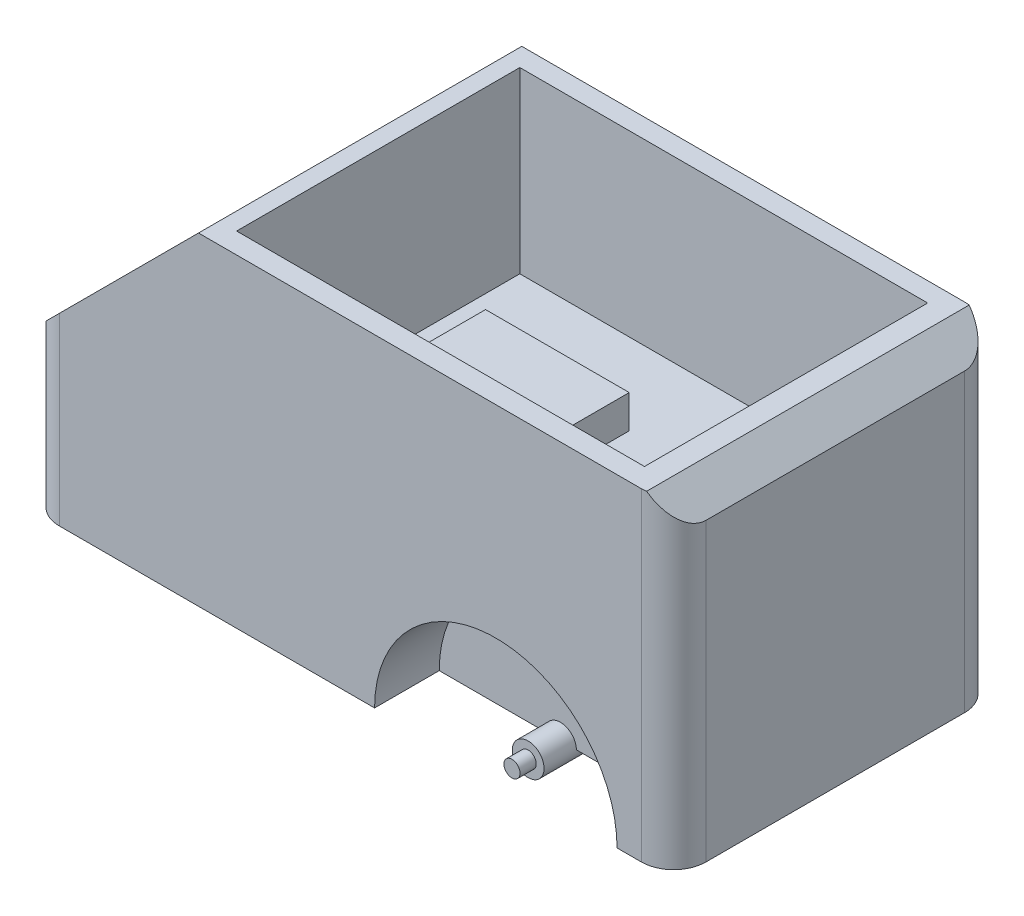
from build123d import *

# Parameters (mm, degrees)
BOSS_EXTRUDE1_DEPTH      = 101.6
SKETCH4_R                = 38.1
CUT_EXTRUDE1_DEPTH       = 20.32
BOSS_EXTRUDE3_DEPTH      = 10.16
BOSS_EXTRUDE3_DEPTH_BACK = 71.12
SKETCH5_R                = 4.993753619
BOSS_EXTRUDE4_DEPTH      = 5.08
BOSS_EXTRUDE4_DEPTH_BACK = 86.36
SKETCH6_R                = 2.54
SKETCH8_R                = 19.05
CUT_EXTRUDE2_DEPTH       = 3.175
SKETCH9_W                = 204.446341232
SKETCH9_H                = 212.005576541
CUT_EXTRUDE3_DEPTH       = 38.1
SKETCH10_W               = 191.95217793
SKETCH10_H               = 158.555264397
CUT_EXTRUDE4_DEPTH       = 6.096
SKETCH11_W               = 128.165166247
SKETCH11_H               = 88.990153167
CUT_EXTRUDE5_DEPTH       = 56.134
SKETCH12_W               = 45.159356145
SKETCH12_H               = 41.954498612
SKETCH12_W_2             = 24.473457524
SKETCH12_H_2             = 41.272764935
SKETCH12_H_3             = 38.685517003
BOSS_EXTRUDE5_DEPTH      = 10.414


with BuildPart() as part:
    # Sketch1 → Boss-Extrude1 (new body)
    with BuildSketch(Plane(origin=(0, 0, 0), x_dir=(1, 0, 0), z_dir=(0, 1, 0))):
        with BuildLine():
            Line((-91.44, 50.8), (91.44, 50.8))
            ThreePointArc((91.44, 50.8), (98.624204897, 47.824204897), (101.6, 40.64))
            Line((101.6, 40.64), (101.6, -40.64))
            ThreePointArc((101.6, -40.64), (98.624204897, -47.824204897), (91.44, -50.8))
            Line((91.44, -50.8), (-91.44, -50.8))
            ThreePointArc((-91.44, -50.8), (-98.624204897, -47.824204897), (-101.6, -40.64))
            Line((-101.6, -40.64), (-101.6, 40.64))
            ThreePointArc((-101.6, 40.64), (-98.624204897, 47.824204897), (-91.44, 50.8))
        make_face()
    extrude(amount=BOSS_EXTRUDE1_DEPTH)

    # Sketch4 → Cut-Extrude1 (cut)
    with BuildSketch(Plane(origin=(0, 0, -50.8), x_dir=(-1, 0, 0), z_dir=(0, 0, -1))):
        with Locations((-45.716232369, 0)):
            Circle(SKETCH4_R)
    cut_extrude1 = extrude(amount=-CUT_EXTRUDE1_DEPTH, mode=Mode.SUBTRACT)

    # Mirror1: Cut-Extrude1 across plane
    add(cut_extrude1.mirror(Plane.XY), mode=Mode.SUBTRACT)

    # Sketch5 → Boss-Extrude3 (add, two sides: drawn at the far end of the back side and taken through both)
    with BuildSketch(Plane(origin=(0, 0, -30.48), x_dir=(-1, 0, 0), z_dir=(0, 0, -1)).offset(-BOSS_EXTRUDE3_DEPTH_BACK)):
        with Locations((-45.716232369, 0)):
            Circle(SKETCH5_R)
    extrude(amount=BOSS_EXTRUDE3_DEPTH + BOSS_EXTRUDE3_DEPTH_BACK)

    # Sketch6 → Boss-Extrude4 (add, two sides: drawn at the far end of the back side and taken through both)
    with BuildSketch(Plane(origin=(0, 0, -40.64), x_dir=(-1, 0, 0), z_dir=(0, 0, -1)).offset(-BOSS_EXTRUDE4_DEPTH_BACK)):
        with Locations((-45.716232369, 0)):
            Circle(SKETCH6_R)
    extrude(amount=BOSS_EXTRUDE4_DEPTH + BOSS_EXTRUDE4_DEPTH_BACK)

    # Sketch8 → Cut-Extrude2 (cut)
    with BuildSketch(Plane(origin=(0, 0, 0), x_dir=(1, 0, 0), z_dir=(0, 1, 0))):
        with Locations(Location((-63.77539901, 0, 0), (0, 0, 270))):
            Circle(SKETCH8_R)
    extrude(amount=CUT_EXTRUDE2_DEPTH, mode=Mode.SUBTRACT)

    # Sketch9 → Cut-Extrude3 (cut)
    with BuildSketch(Plane(origin=(-101.6, 101.6, 0), x_dir=(0, 0, 1), z_dir=(-0.7071067811865512, 0.7071067811865438, 0))):
        with Locations((0, 45.254668325)):
            Rectangle(SKETCH9_W, SKETCH9_H)
    extrude(amount=-CUT_EXTRUDE3_DEPTH, mode=Mode.SUBTRACT)

    # Sketch10 → Cut-Extrude4 (cut)
    with BuildSketch(Plane(origin=(101.6, 101.6, 0), x_dir=(0, 0, -1), z_dir=(-0.7071067811865512, -0.7071067811865438, 0))):
        with Locations((0, 44.355551834)):
            Rectangle(SKETCH10_W, SKETCH10_H)
    extrude(amount=CUT_EXTRUDE4_DEPTH, mode=Mode.SUBTRACT)

    # Sketch11 → Cut-Extrude5 (cut)
    with BuildSketch(Plane(origin=(0, 101.6, 0), x_dir=(1, 0, 0), z_dir=(0, 1, 0))):
        with Locations((21.822922161, 0.221645033)):
            Rectangle(SKETCH11_W, SKETCH11_H)
    extrude(amount=-CUT_EXTRUDE5_DEPTH, mode=Mode.SUBTRACT)

    # Sketch12 → Boss-Extrude5 (add)
    with BuildSketch(Plane(origin=(0, 45.466, 0), x_dir=(1, 0, 0), z_dir=(0, 1, 0))):
        with Locations((-4.914184507, -1.800355644)):
            Rectangle(SKETCH12_W, SKETCH12_H)
        with Locations((63.116200395, 24.08033915)):
            Rectangle(SKETCH12_W_2, SKETCH12_H_2)
        with Locations((63.116200395, -24.930673049)):
            Rectangle(SKETCH12_W_2, SKETCH12_H_3)
    extrude(amount=BOSS_EXTRUDE5_DEPTH)


solid = part.part
